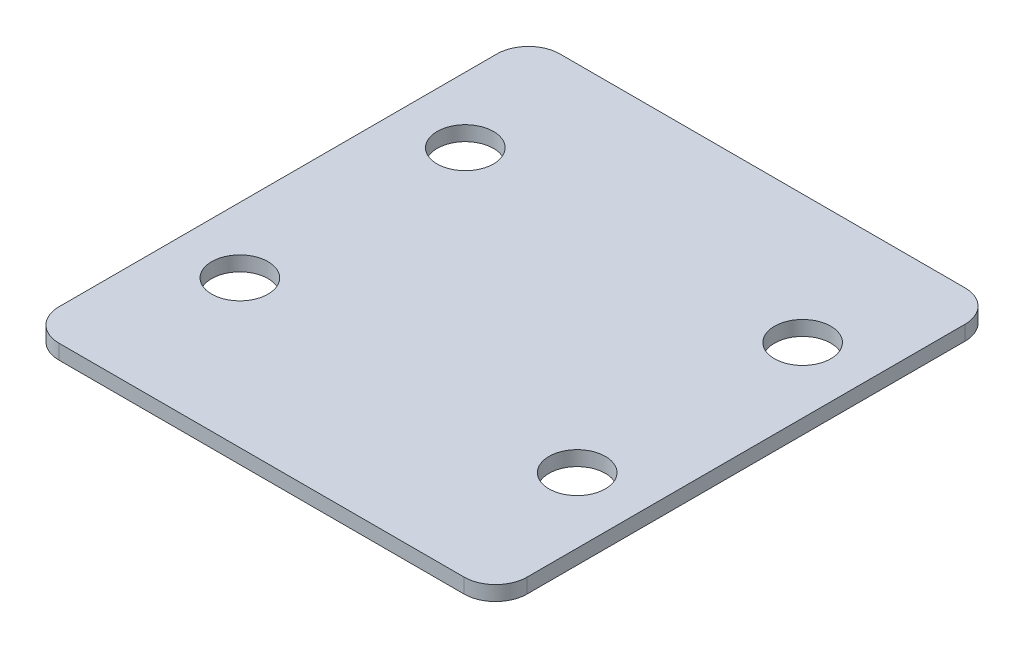
from build123d import *

# Parameters (mm, degrees)
BOSS_EXTRUDE1_DEPTH     = 28.2702
SKETCH2_R               = 3.556
SKETCH2_R_2             = 1.4986
SKETCH2_R_3             = 2.0066
MOTOR_MOUNT_HOLES_DEPTH = 50.437835996
SKETCH3_R               = 1.7018
PLATE_MOUNT_HOLES_DEPTH = 51.700550556
SKETCH4_W               = 28.2702
SKETCH4_H               = 29.2608
CUT_EXTRUDE1_DEPTH      = 50.437835996
FILLET1_R               = 1.905


with BuildPart() as part:
    # Sketch1 → Boss-Extrude1 (new body)
    with BuildSketch(Plane(origin=(0, 0, 0), x_dir=(0, 0, -1), z_dir=(1, 0, 0))):
        Polygon((0, 0), (0, -30.1498), (-30.2514, -30.1498), (-30.2514, -29.2608), (-3.1242, -29.2608), (-3.1242, 0), align=None)
    extrude(amount=BOSS_EXTRUDE1_DEPTH)

    # Sketch2 → Motor_Mount_holes (cut, through all)
    with BuildSketch(Plane.XY.offset(3.1242)):
        with Locations((14.1351, -11.6586)):
            Circle(SKETCH2_R)
        with Locations((14.1351, -3.1496)):
            Circle(SKETCH2_R_2)
        with Locations((5.2451, -11.6586)):
            Circle(SKETCH2_R_3)
        with Locations(Location((23.0251, -11.6586, 0), (0, 0, 180))):
            Circle(SKETCH2_R_3)
        with Locations(Location((14.1351, -20.1676, 0), (0, 0, 180))):
            Circle(SKETCH2_R_2)
    extrude(amount=-MOTOR_MOUNT_HOLES_DEPTH, mode=Mode.SUBTRACT)

    # Sketch3 → Plate_Mount_Holes (cut, through all)
    with BuildSketch(Plane(origin=(0, -29.2608, 0), x_dir=(1, 0, 0), z_dir=(0, 1, 0))):
        with Locations(Location((24.3205, -7.7597, 0), (0, 0, 270))):
            Circle(SKETCH3_R)
        with Locations(Location((3.9497, -7.7597, 0), (0, 0, 90))):
            Circle(SKETCH3_R)
        with Locations(Location((3.9497, -21.3741, 0), (0, 0, 270))):
            Circle(SKETCH3_R)
        with Locations(Location((24.3205, -21.3741, 0), (0, 0, 90))):
            Circle(SKETCH3_R)
    extrude(amount=-PLATE_MOUNT_HOLES_DEPTH, mode=Mode.SUBTRACT)

    # Sketch4 → Cut-Extrude1 (cut, through all)
    with BuildSketch(Plane.XY.offset(3.1242)):
        with Locations((14.1351, -14.6304)):
            Rectangle(SKETCH4_W, SKETCH4_H)
    extrude(amount=-CUT_EXTRUDE1_DEPTH, mode=Mode.SUBTRACT)

    # Fillet1
    fillet1_edges = [part.edges().sort_by_distance(p)[0] for p in [
        (28.2702, -29.7053, 30.2514),
        (28.2702, -29.7053, 0),
        (0, -29.7053, 0),
        (0, -29.7053, 30.2514),
    ]]
    fillet(fillet1_edges, radius=FILLET1_R)


solid = part.part
